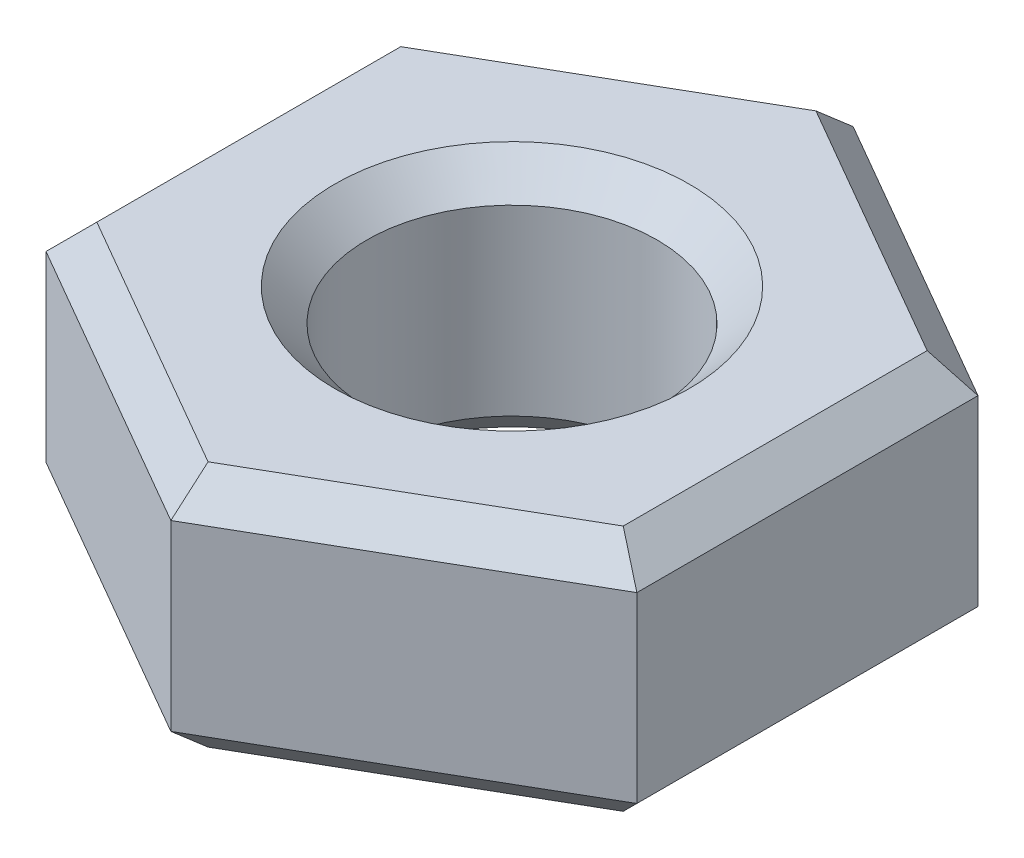
from build123d import *

# Parameters (mm, degrees)
SKETCH1_R           = 1.35
BOSS_EXTRUDE1_DEPTH = 2.3
CHAMFER1_SIZE       = 0.3


with BuildPart() as part:
    # Sketch1 → Boss-Extrude1 (new body)
    with BuildSketch(Plane(origin=(0, 0, 0), x_dir=(1, 0, 0), z_dir=(0, 1, 0))):
        Polygon((2.75, -1.58771324), (2.75, 1.58771324), (0, 3.175426481), (-2.75, 1.58771324), (-2.75, -1.58771324), (0, -3.175426481), align=None)
        with Locations(Location((0, 0, 0), (0, 0, 270))):
            Circle(SKETCH1_R, mode=Mode.SUBTRACT)
    extrude(amount=BOSS_EXTRUDE1_DEPTH)

    # Chamfer1
    chamfer1_edges = [part.edges().sort_by_distance(p)[0] for p in [
        (1.375, 2.3, -2.38156986),
        (-1.375, 2.3, -2.38156986),
        (-2.75, 2.3, 0),
        (0, 0, -1.35),
        (0, 2.3, -1.35),
        (-1.375, 2.3, 2.38156986),
        (1.375, 2.3, 2.38156986),
        (-1.375, 0, 2.38156986),
        (-2.75, 0, 0),
        (-1.375, 0, -2.38156986),
        (2.75, 2.3, 0),
        (1.375, 0, -2.38156986),
        (2.75, 0, 0),
        (1.375, 0, 2.38156986),
    ]]
    chamfer(chamfer1_edges, length=CHAMFER1_SIZE)


solid = part.part
